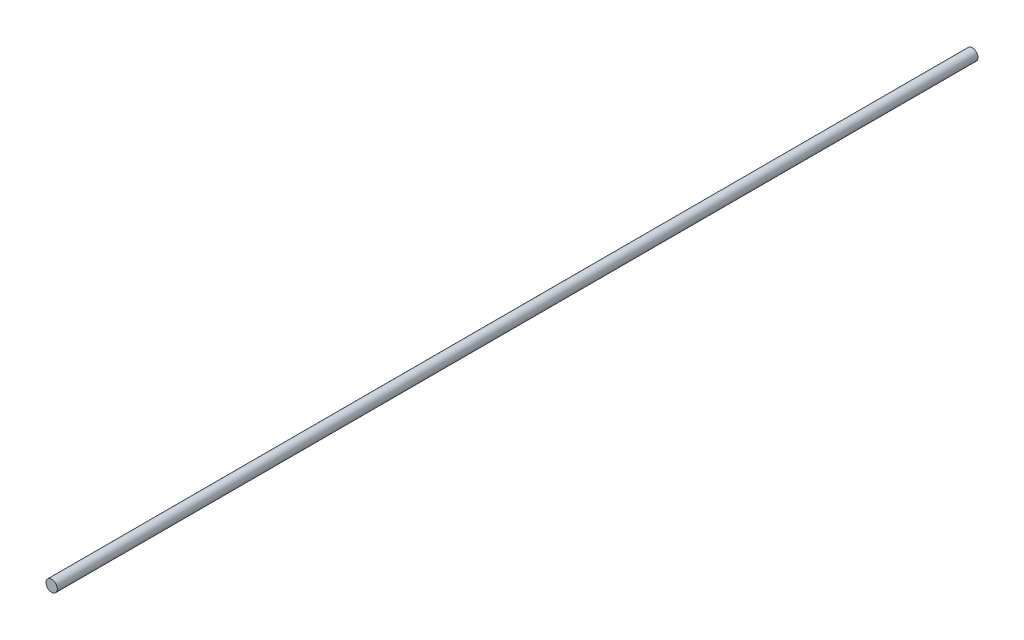
from build123d import *

# Parameters (mm, degrees)
SKETCH_1_R      = 4
EXTRUDE_1_DEPTH = 650


with BuildPart() as part:
    # 스케치1 → 보스-돌출1 (new body)
    with BuildSketch(Plane.XY):
        Circle(SKETCH_1_R)
    extrude(amount=EXTRUDE_1_DEPTH)


solid = part.part
